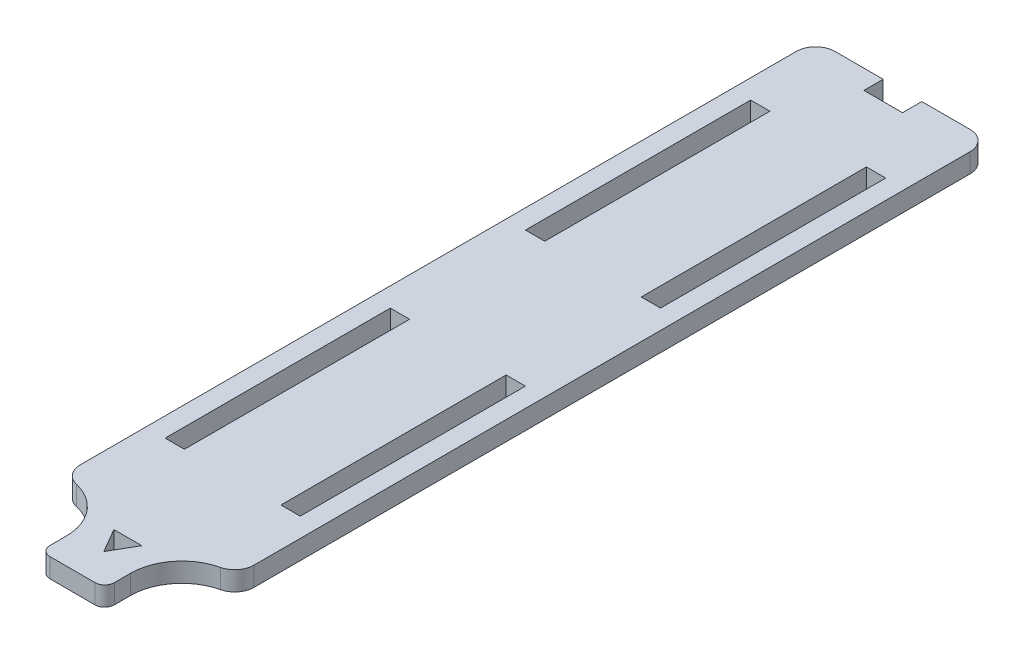
from build123d import *
from OCP.BRepFilletAPI import BRepFilletAPI_MakeFillet

# Parameters (mm, degrees)
SKETCH1_W               = 27
SKETCH1_H               = 129
BOSS_EXTRUDE1_DEPTH     = 1.5
FILLET1_R               = 3
CUT_EXTRUDE2_DEPTH      = 66.914717628
CUT_EXTRUDE2_DEPTH_BACK = 66.914717628
SKETCH3_W               = 6
SKETCH3_H               = 3
CUT_EXTRUDE4_DEPTH      = 66.914717628
CUT_EXTRUDE4_DEPTH_BACK = 66.914717628
FILLET2_R1              = 3
FILLET2_R2              = 1.5
CUT_EXTRUDE3_DEPTH      = 5
CUT_EXTRUDE1_DEPTH      = 66.914717749
CUT_EXTRUDE1_DEPTH_BACK = 66.914717749
SKETCH2_W               = 3
SKETCH2_H               = 35


with BuildPart() as part:
    # Sketch1 → Boss-Extrude1 (new, symmetric)
    with BuildSketch(Plane(origin=(0, 0, 0), x_dir=(1, 0, 0), z_dir=(0, 1, 0))):
        Rectangle(SKETCH1_W, SKETCH1_H)
    extrude(amount=BOSS_EXTRUDE1_DEPTH, both=True)

    # Fillet1
    fillet1_edges = [part.edges().sort_by_distance(p)[0] for p in [
        (13.5, 0, -64.5),
        (-13.5, 0, -64.5),
    ]]
    fillet(fillet1_edges, radius=FILLET1_R)

    # Sketch3 → Cut-Extrude2 (cut, two sides: drawn at the far end of the back side and taken through both)
    with BuildSketch(Plane(origin=(0, 0, 0), x_dir=(1, 0, 0), z_dir=(0, 1, 0)).offset(-CUT_EXTRUDE2_DEPTH_BACK)):
        with Locations((0, 63)):
            Rectangle(SKETCH3_W, SKETCH3_H)
    extrude(amount=CUT_EXTRUDE2_DEPTH + CUT_EXTRUDE2_DEPTH_BACK, mode=Mode.SUBTRACT)

    # Sketch5 → Cut-Extrude4 (cut, two sides: drawn at the far end of the back side and taken through both)
    with BuildSketch(Plane(origin=(0, 0, 0), x_dir=(1, 0, 0), z_dir=(0, 1, 0)).offset(-CUT_EXTRUDE4_DEPTH_BACK)):
        with BuildLine():
            Line((-13.5, -52.5), (-13, -52.5))
            ThreePointArc((-13, -52.5), (-7.343145751, -54.843145751), (-5, -60.5))
            Line((-5, -60.5), (-5, -64.5))
            Line((-5, -64.5), (-13.5, -64.5))
            Line((-13.5, -64.5), (-13.5, -52.5))
        make_face()
        with BuildLine():
            Line((5, -60.5), (5, -64.5))
            Line((5, -64.5), (13.5, -64.5))
            Line((13.5, -64.5), (13.5, -52.5))
            Line((13.5, -52.5), (13, -52.5))
            ThreePointArc((13, -52.5), (7.343145751, -54.843145751), (5, -60.5))
        make_face()
    extrude(amount=CUT_EXTRUDE4_DEPTH + CUT_EXTRUDE4_DEPTH_BACK, mode=Mode.SUBTRACT)

    # Fillet2: one fillet with a radius per group of edges: ONE call of the kernel's fillet builder (fillet() takes one radius for all edges)
    fillet2_edges_1 = [part.edges().sort_by_distance(p)[0] for p in [
        (-13.5, 0, 52.5),
        (13.5, 0, 52.5),
    ]]
    fillet2_edges_2 = [part.edges().sort_by_distance(p)[0] for p in [
        (-5, 0, 64.5),
        (5, 0, 64.5),
    ]]
    fillet2 = BRepFilletAPI_MakeFillet(part.part.solid().wrapped)
    for e in fillet2_edges_1:
        fillet2.Add(FILLET2_R1, e.wrapped)
    for e in fillet2_edges_2:
        fillet2.Add(FILLET2_R2, e.wrapped)
    add(Compound.cast(fillet2.Shape()), mode=Mode.REPLACE)

    # Sketch4 → Cut-Extrude3 (cut, symmetric)
    with BuildSketch(Plane(origin=(0, 0, 0), x_dir=(1, 0, 0), z_dir=(0, 1, 0))):
        Polygon((0, -59.643928679), (2.165063509, -55.893928679), (-2.165063509, -55.893928679), align=None)
    extrude(amount=CUT_EXTRUDE3_DEPTH, both=True, mode=Mode.SUBTRACT)

    # Sketch2 → Cut-Extrude1 (cut, two sides: drawn at the far end of the back side and taken through both)
    with BuildSketch(Plane(origin=(0, 0, 0), x_dir=(1, 0, 0), z_dir=(0, 1, 0)).offset(-CUT_EXTRUDE1_DEPTH_BACK)):
        with Locations((-9, 33.895)):
            Rectangle(SKETCH2_W, SKETCH2_H)
        with Locations((9, 33.895)):
            Rectangle(SKETCH2_W, SKETCH2_H)
        with Locations((9, -22.105)):
            Rectangle(SKETCH2_W, SKETCH2_H)
        with Locations((-9, -22.105)):
            Rectangle(SKETCH2_W, SKETCH2_H)
    extrude(amount=CUT_EXTRUDE1_DEPTH + CUT_EXTRUDE1_DEPTH_BACK, mode=Mode.SUBTRACT)


solid = part.part
